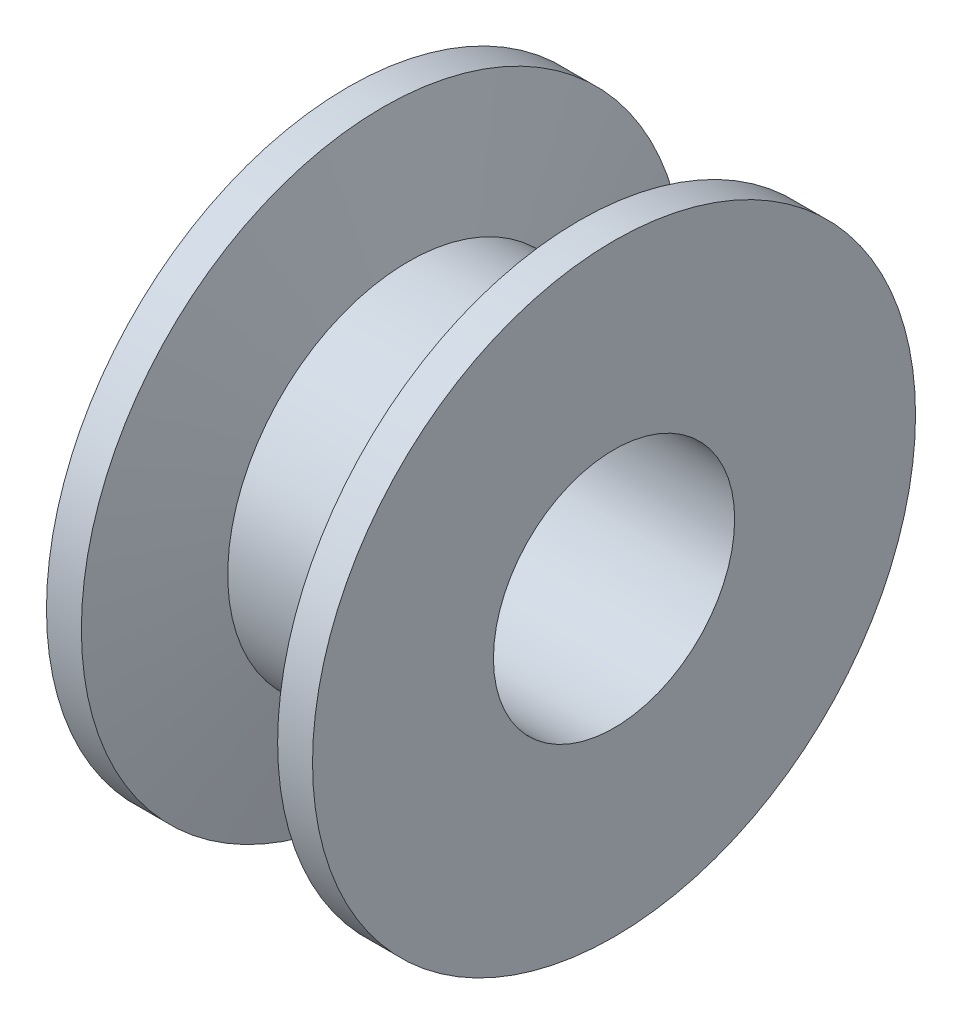
from build123d import *


with BuildPart() as part:
    # Sketch1 → Revolve3 (revolve)
    with BuildSketch(Plane.XY, mode=Mode.PRIVATE) as revolve3_sk:
        Polygon((-6, 15), (6, 15), (8.136574106, 25), (11.03145243, 25), (11.03145243, 10), (-11.03145243, 10), (-11.03145243, 25), (-8.136574106, 25), align=None)
    revolve(revolve3_sk.sketch.rotate(Axis((11.03145243, 0, 0), (-1, 0, 0)), 90), axis=Axis((11.03145243, 0, 0), (-1, 0, 0)))


solid = part.part
